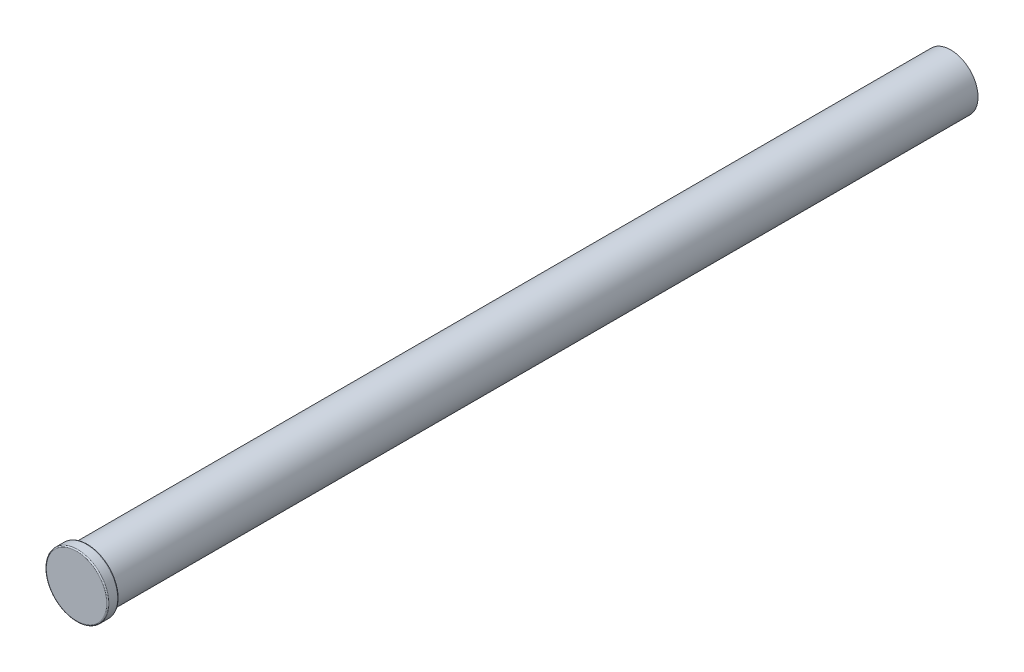
from build123d import *

# Parameters (mm, degrees)
SKETCH1_R           = 9
BOSS_EXTRUDE1_DEPTH = 80
SKETCH2_R           = 2
CUT_EXTRUDE1_DEPTH  = 15
SKETCH3_R           = 9
SKETCH3_R_2         = 2.5
CUT_EXTRUDE3_DEPTH  = 112
SKETCH6_R           = 2.86034934
BOSS_EXTRUDE2_DEPTH = 1
FILLET1_R           = 0.1


with BuildPart() as part:
    # Sketch1 → Boss-Extrude1 (new body)
    with BuildSketch(Plane.XY):
        Circle(SKETCH1_R)
    extrude(amount=BOSS_EXTRUDE1_DEPTH)

    # Sketch2 → Cut-Extrude1 (cut)
    with BuildSketch(Plane(origin=(0, 0, 0), x_dir=(-1, 0, 0), z_dir=(0, 0, -1))):
        Circle(SKETCH2_R)
    extrude(amount=-CUT_EXTRUDE1_DEPTH, mode=Mode.SUBTRACT)

    # Sketch3 → Cut-Extrude3 (cut)
    with BuildSketch(Plane(origin=(0, 0, 0), x_dir=(-1, 0, 0), z_dir=(0, 0, -1))):
        Circle(SKETCH3_R)
        Circle(SKETCH3_R_2, mode=Mode.SUBTRACT)
    extrude(amount=-CUT_EXTRUDE3_DEPTH, mode=Mode.SUBTRACT)

    # Sketch6 → Boss-Extrude2 (add)
    with BuildSketch(Plane.XY.offset(80)):
        Circle(SKETCH6_R)
    extrude(amount=-BOSS_EXTRUDE2_DEPTH)

    # Fillet1
    fillet1_edges = [part.edges().sort_by_distance(p)[0] for p in [
        (2.5, 0, 79),
        (-2.86034934, 0, 79),
        (-2.86034934, 0, 80),
    ]]
    fillet(fillet1_edges, radius=FILLET1_R)


solid = part.part
